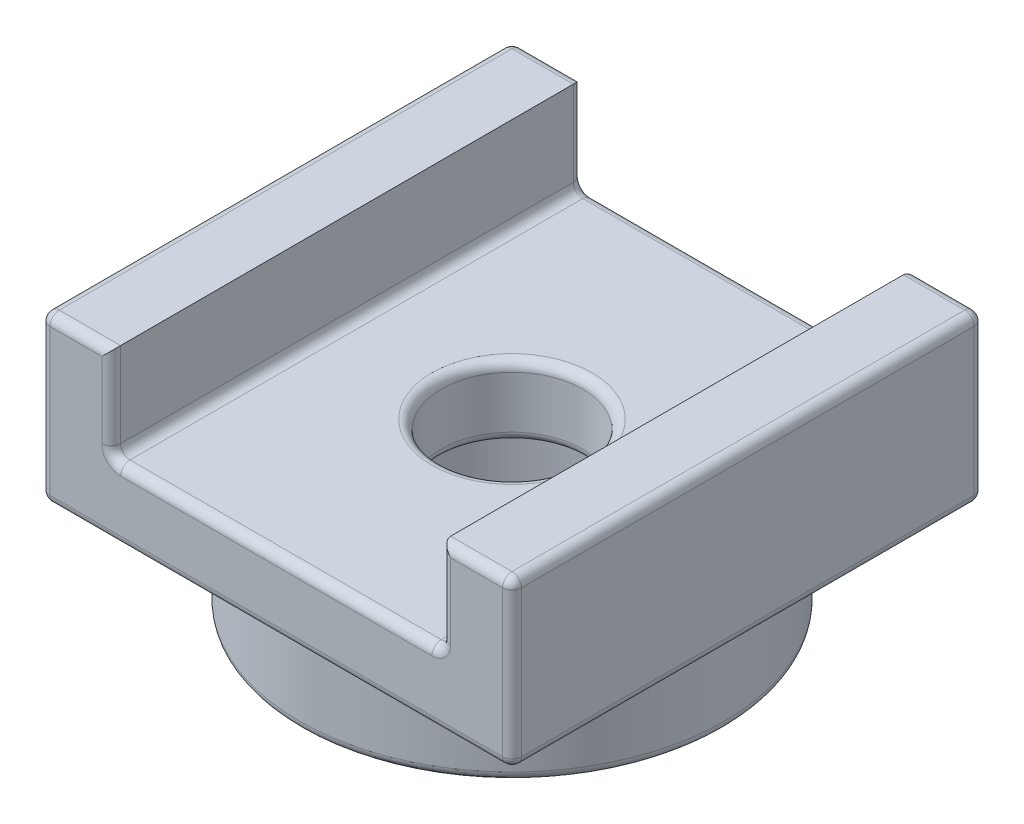
from build123d import *

# Parameters (mm, degrees)
CROQUIS1_W              = 10
CROQUIS1_H              = 10
CROQUIS1_R              = 1.5
SALIENTE_EXTRUIR1_DEPTH = 1.5
CROQUIS2_W              = 1.5
CROQUIS2_H              = 10
SALIENTE_EXTRUIR2_DEPTH = 2
CROQUIS3_R              = 4.5
CROQUIS3_R_2            = 3
SALIENTE_EXTRUIR3_DEPTH = 2
REDONDEO1_R             = 0.2
REDONDEO3_R             = 0.2


with BuildPart() as part:
    # Croquis1 → Saliente-Extruir1 (new body)
    with BuildSketch(Plane(origin=(0, 0, 0), x_dir=(1, 0, 0), z_dir=(0, 1, 0))):
        Rectangle(CROQUIS1_W, CROQUIS1_H)
        with Locations(Location((0, 0, 0), (0, 0, 270))):
            Circle(CROQUIS1_R, mode=Mode.SUBTRACT)
    extrude(amount=SALIENTE_EXTRUIR1_DEPTH)

    # Croquis2 → Saliente-Extruir2 (add)
    with BuildSketch(Plane(origin=(0, 1.5, 0), x_dir=(1, 0, 0), z_dir=(0, 1, 0))):
        with Locations((-4.25, 0)):
            Rectangle(CROQUIS2_W, CROQUIS2_H)
        with Locations((4.25, 0)):
            Rectangle(CROQUIS2_W, CROQUIS2_H)
    extrude(amount=SALIENTE_EXTRUIR2_DEPTH)

    # Croquis3 → Saliente-Extruir3 (add)
    with BuildSketch(Plane.XZ):
        with Locations(Location((0, 0, 0), (0, 0, 270))):
            Circle(CROQUIS3_R)
        with Locations(Location((0, 0, 0), (0, 0, 270))):
            Circle(CROQUIS3_R_2, mode=Mode.SUBTRACT)
    extrude(amount=SALIENTE_EXTRUIR3_DEPTH)

    # Redondeo1
    redondeo1_edges = [part.edges().sort_by_distance(p)[0] for p in [
        (0, 0, 3),
        (0, -2, 4.5),
        (0, 0, 4.5),
        (0, -2, 3),
    ]]
    fillet(redondeo1_edges, radius=REDONDEO1_R)

    # Redondeo3
    redondeo3_edges = [part.edges().sort_by_distance(p)[0] for p in [
        (0, 0, -1.5),
        (0, 1.5, -1.5),
        (0, 1.5, 5),
        (-3.5, 2.5, 5),
        (-3.5, 2.5, -5),
        (-4.25, 3.5, -5),
        (-5, 3.5, 0),
        (-4.25, 3.5, 5),
        (-3.5, 1.5, 0),
        (0, 1.5, -5),
        (3.5, 1.5, 0),
        (3.5, 2.5, -5),
        (3.5, 2.5, 5),
        (4.25, 3.5, -5),
        (4.25, 3.5, 5),
        (5, 3.5, 0),
        (0, 0, -5),
        (5, 0, 0),
        (0, 0, 5),
        (-5, 0, 0),
        (-5, 1.75, -5),
        (5, 1.75, -5),
        (5, 1.75, 5),
        (-5, 1.75, 5),
    ]]
    fillet(redondeo3_edges, radius=REDONDEO3_R)


solid = part.part
